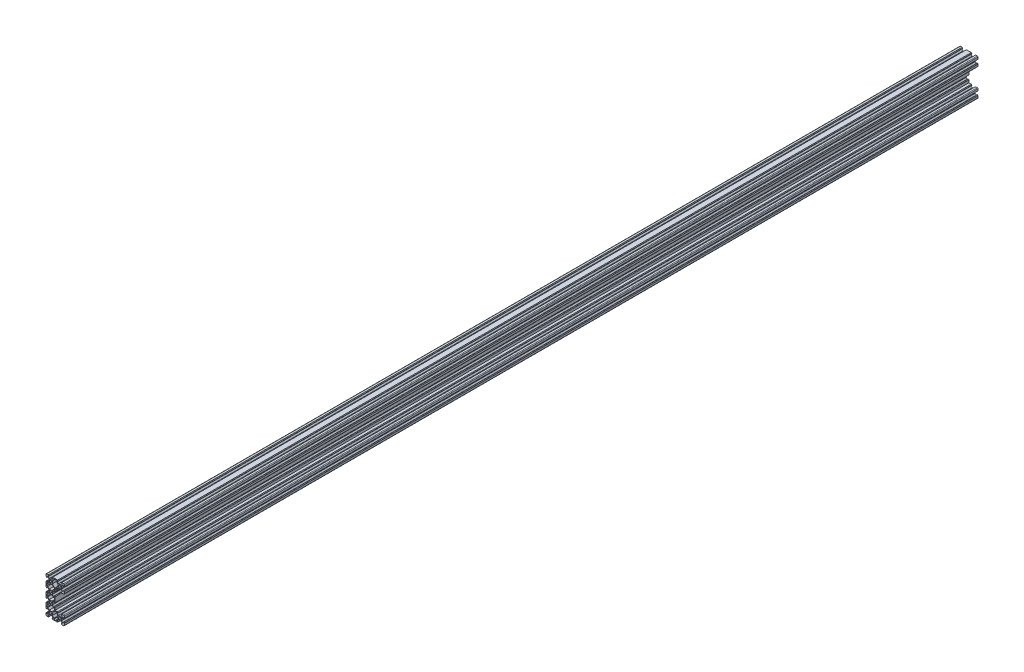
from build123d import *

# Parameters (mm, degrees)
SKETCH1_R           = 2.3
BOSS_EXTRUDE1_DEPTH = 1000


with BuildPart() as part:
    # Sketch1 → Boss-Extrude1 (new, symmetric)
    with BuildSketch(Plane.XY):
        with BuildLine():
            Line((-20, -34.58), (-20, -38.5))
            ThreePointArc((-20, -38.5), (-19.560660172, -39.560660172), (-18.5, -40))
            Line((-18.5, -40), (-14.58, -40))
            Line((-14.58, -40), (-13.395, -38.815))
            Line((-13.395, -38.815), (-13.395, -38.2))
            Line((-13.395, -38.2), (-15.5, -38.2))
            Line((-15.5, -38.2), (-15.5, -36.560660172))
            Line((-15.5, -36.560660172), (-12.839339828, -33.9))
            Line((-12.839339828, -33.9), (-10.21, -33.9))
            Line((-10.21, -33.9), (-10, -33.69))
            Line((-10, -33.69), (-9.79, -33.9))
            Line((-9.79, -33.9), (-7.160660172, -33.9))
            Line((-7.160660172, -33.9), (-4.5, -36.560660172))
            Line((-4.5, -36.560660172), (-4.5, -38.2))
            Line((-4.5, -38.2), (-6.605, -38.2))
            Line((-6.605, -38.2), (-6.605, -38.815))
            Line((-6.605, -38.815), (-5.42, -40))
            Line((-5.42, -40), (5.42, -40))
            Line((5.42, -40), (6.605, -38.815))
            Line((6.605, -38.815), (6.605, -38.2))
            Line((6.605, -38.2), (4.5, -38.2))
            Line((4.5, -38.2), (4.5, -36.560660172))
            Line((4.5, -36.560660172), (7.160660172, -33.9))
            Line((7.160660172, -33.9), (9.79, -33.9))
            Line((9.79, -33.9), (10, -33.69))
            Line((10, -33.69), (10.21, -33.9))
            Line((10.21, -33.9), (12.839339828, -33.9))
            Line((12.839339828, -33.9), (15.5, -36.560660172))
            Line((15.5, -36.560660172), (15.5, -38.2))
            Line((15.5, -38.2), (13.395, -38.2))
            Line((13.395, -38.2), (13.395, -38.815))
            Line((13.395, -38.815), (14.58, -40))
            Line((14.58, -40), (18.5, -40))
            ThreePointArc((18.5, -40), (19.560660172, -39.560660172), (20, -38.5))
            Line((20, -38.5), (20, -34.58))
            Line((20, -34.58), (18.815, -33.395))
            Line((18.815, -33.395), (18.2, -33.395))
            Line((18.2, -33.395), (18.2, -35.5))
            Line((18.2, -35.5), (16.560660172, -35.5))
            Line((16.560660172, -35.5), (13.9, -32.839339828))
            Line((13.9, -32.839339828), (13.9, -30.21))
            Line((13.9, -30.21), (13.69, -30))
            Line((13.69, -30), (13.9, -29.79))
            Line((13.9, -29.79), (13.9, -27.160660172))
            Line((13.9, -27.160660172), (16.560660172, -24.5))
            Line((16.560660172, -24.5), (18.2, -24.5))
            Line((18.2, -24.5), (18.2, -26.605))
            Line((18.2, -26.605), (18.815, -26.605))
            Line((18.815, -26.605), (20, -25.42))
            Line((20, -25.42), (20, -21.5))
            ThreePointArc((20, -21.5), (19.560660172, -20.439339828), (18.5, -20))
            Line((18.5, -20), (14.58, -20))
            Line((14.58, -20), (13.395, -21.185))
            Line((13.395, -21.185), (13.395, -21.8))
            Line((13.395, -21.8), (15.5, -21.8))
            Line((15.5, -21.8), (15.5, -23.439339828))
            Line((15.5, -23.439339828), (12.839339828, -26.1))
            Line((12.839339828, -26.1), (10.21, -26.1))
            Line((10.21, -26.1), (10, -26.31))
            Line((10, -26.31), (9.79, -26.1))
            Line((9.79, -26.1), (7.160660172, -26.1))
            Line((7.160660172, -26.1), (4.5, -23.439339828))
            Line((4.5, -23.439339828), (4.5, -21.8))
            Line((4.5, -21.8), (6.605, -21.8))
            Line((6.605, -21.8), (6.605, -21.185))
            Line((6.605, -21.185), (5.42, -20))
            Line((5.42, -20), (0, -20))
            Line((0, -20), (0, -14.58))
            Line((0, -14.58), (-1.185, -13.395))
            Line((-1.185, -13.395), (-1.8, -13.395))
            Line((-1.8, -13.395), (-1.8, -15.5))
            Line((-1.8, -15.5), (-3.439339828, -15.5))
            Line((-3.439339828, -15.5), (-6.1, -12.839339828))
            Line((-6.1, -12.839339828), (-6.1, -10.21))
            Line((-6.1, -10.21), (-6.31, -10))
            Line((-6.31, -10), (-6.1, -9.79))
            Line((-6.1, -9.79), (-6.1, -7.160660172))
            Line((-6.1, -7.160660172), (-3.439339828, -4.5))
            Line((-3.439339828, -4.5), (-1.8, -4.5))
            Line((-1.8, -4.5), (-1.8, -6.605))
            Line((-1.8, -6.605), (-1.185, -6.605))
            Line((-1.185, -6.605), (0, -5.42))
            Line((0, -5.42), (0, 5.42))
            Line((0, 5.42), (-1.185, 6.605))
            Line((-1.185, 6.605), (-1.8, 6.605))
            Line((-1.8, 6.605), (-1.8, 4.5))
            Line((-1.8, 4.5), (-3.439339828, 4.5))
            Line((-3.439339828, 4.5), (-6.1, 7.160660172))
            Line((-6.1, 7.160660172), (-6.1, 9.79))
            Line((-6.1, 9.79), (-6.31, 10))
            Line((-6.31, 10), (-6.1, 10.21))
            Line((-6.1, 10.21), (-6.1, 12.839339828))
            Line((-6.1, 12.839339828), (-3.439339828, 15.5))
            Line((-3.439339828, 15.5), (-1.8, 15.5))
            Line((-1.8, 15.5), (-1.8, 13.395))
            Line((-1.8, 13.395), (-1.185, 13.395))
            Line((-1.185, 13.395), (0, 14.58))
            Line((0, 14.58), (0, 20))
            Line((0, 20), (5.42, 20))
            Line((5.42, 20), (6.605, 21.185))
            Line((6.605, 21.185), (6.605, 21.8))
            Line((6.605, 21.8), (4.5, 21.8))
            Line((4.5, 21.8), (4.5, 23.439339828))
            Line((4.5, 23.439339828), (7.160660172, 26.1))
            Line((7.160660172, 26.1), (9.79, 26.1))
            Line((9.79, 26.1), (10, 26.31))
            Line((10, 26.31), (10.21, 26.1))
            Line((10.21, 26.1), (12.839339828, 26.1))
            Line((12.839339828, 26.1), (15.5, 23.439339828))
            Line((15.5, 23.439339828), (15.5, 21.8))
            Line((15.5, 21.8), (13.395, 21.8))
            Line((13.395, 21.8), (13.395, 21.185))
            Line((13.395, 21.185), (14.58, 20))
            Line((14.58, 20), (18.5, 20))
            ThreePointArc((18.5, 20), (19.560660172, 20.439339828), (20, 21.5))
            Line((20, 21.5), (20, 25.42))
            Line((20, 25.42), (18.815, 26.605))
            Line((18.815, 26.605), (18.2, 26.605))
            Line((18.2, 26.605), (18.2, 24.5))
            Line((18.2, 24.5), (16.560660172, 24.5))
            Line((16.560660172, 24.5), (13.9, 27.160660172))
            Line((13.9, 27.160660172), (13.9, 29.79))
            Line((13.9, 29.79), (13.69, 30))
            Line((13.69, 30), (13.9, 30.21))
            Line((13.9, 30.21), (13.9, 32.839339828))
            Line((13.9, 32.839339828), (16.560660172, 35.5))
            Line((16.560660172, 35.5), (18.2, 35.5))
            Line((18.2, 35.5), (18.2, 33.395))
            Line((18.2, 33.395), (18.815, 33.395))
            Line((18.815, 33.395), (20, 34.58))
            Line((20, 34.58), (20, 38.5))
            ThreePointArc((20, 38.5), (19.560660172, 39.560660172), (18.5, 40))
            Line((18.5, 40), (14.58, 40))
            Line((14.58, 40), (13.395, 38.815))
            Line((13.395, 38.815), (13.395, 38.2))
            Line((13.395, 38.2), (15.5, 38.2))
            Line((15.5, 38.2), (15.5, 36.560660172))
            Line((15.5, 36.560660172), (12.839339828, 33.9))
            Line((12.839339828, 33.9), (10.21, 33.9))
            Line((10.21, 33.9), (10, 33.69))
            Line((10, 33.69), (9.79, 33.9))
            Line((9.79, 33.9), (7.160660172, 33.9))
            Line((7.160660172, 33.9), (4.5, 36.560660172))
            Line((4.5, 36.560660172), (4.5, 38.2))
            Line((4.5, 38.2), (6.605, 38.2))
            Line((6.605, 38.2), (6.605, 38.815))
            Line((6.605, 38.815), (5.42, 40))
            Line((5.42, 40), (-5.42, 40))
            Line((-5.42, 40), (-6.605, 38.815))
            Line((-6.605, 38.815), (-6.605, 38.2))
            Line((-6.605, 38.2), (-4.5, 38.2))
            Line((-4.5, 38.2), (-4.5, 36.560660172))
            Line((-4.5, 36.560660172), (-7.160660172, 33.9))
            Line((-7.160660172, 33.9), (-9.79, 33.9))
            Line((-9.79, 33.9), (-10, 33.69))
            Line((-10, 33.69), (-10.21, 33.9))
            Line((-10.21, 33.9), (-12.839339828, 33.9))
            Line((-12.839339828, 33.9), (-15.5, 36.560660172))
            Line((-15.5, 36.560660172), (-15.5, 38.2))
            Line((-15.5, 38.2), (-13.395, 38.2))
            Line((-13.395, 38.2), (-13.395, 38.815))
            Line((-13.395, 38.815), (-14.58, 40))
            Line((-14.58, 40), (-18.5, 40))
            ThreePointArc((-18.5, 40), (-19.560660172, 39.560660172), (-20, 38.5))
            Line((-20, 38.5), (-20, 34.58))
            Line((-20, 34.58), (-18.815, 33.395))
            Line((-18.815, 33.395), (-18.2, 33.395))
            Line((-18.2, 33.395), (-18.2, 35.5))
            Line((-18.2, 35.5), (-16.560660172, 35.5))
            Line((-16.560660172, 35.5), (-13.9, 32.839339828))
            Line((-13.9, 32.839339828), (-13.9, 30.21))
            Line((-13.9, 30.21), (-13.69, 30))
            Line((-13.69, 30), (-13.9, 29.79))
            Line((-13.9, 29.79), (-13.9, 27.160660172))
            Line((-13.9, 27.160660172), (-16.560660172, 24.5))
            Line((-16.560660172, 24.5), (-18.2, 24.5))
            Line((-18.2, 24.5), (-18.2, 26.605))
            Line((-18.2, 26.605), (-18.815, 26.605))
            Line((-18.815, 26.605), (-20, 25.42))
            Line((-20, 25.42), (-20, 14.58))
            Line((-20, 14.58), (-18.815, 13.395))
            Line((-18.815, 13.395), (-18.2, 13.395))
            Line((-18.2, 13.395), (-18.2, 15.5))
            Line((-18.2, 15.5), (-16.560660172, 15.5))
            Line((-16.560660172, 15.5), (-13.9, 12.839339828))
            Line((-13.9, 12.839339828), (-13.9, 10.21))
            Line((-13.9, 10.21), (-13.69, 10))
            Line((-13.69, 10), (-13.9, 9.79))
            Line((-13.9, 9.79), (-13.9, 7.160660172))
            Line((-13.9, 7.160660172), (-16.560660172, 4.5))
            Line((-16.560660172, 4.5), (-18.2, 4.5))
            Line((-18.2, 4.5), (-18.2, 6.605))
            Line((-18.2, 6.605), (-18.815, 6.605))
            Line((-18.815, 6.605), (-20, 5.42))
            Line((-20, 5.42), (-20, -5.42))
            Line((-20, -5.42), (-18.815, -6.605))
            Line((-18.815, -6.605), (-18.2, -6.605))
            Line((-18.2, -6.605), (-18.2, -4.5))
            Line((-18.2, -4.5), (-16.560660172, -4.5))
            Line((-16.560660172, -4.5), (-13.9, -7.160660172))
            Line((-13.9, -7.160660172), (-13.9, -9.79))
            Line((-13.9, -9.79), (-13.69, -10))
            Line((-13.69, -10), (-13.9, -10.21))
            Line((-13.9, -10.21), (-13.9, -12.839339828))
            Line((-13.9, -12.839339828), (-16.560660172, -15.5))
            Line((-16.560660172, -15.5), (-18.2, -15.5))
            Line((-18.2, -15.5), (-18.2, -13.395))
            Line((-18.2, -13.395), (-18.815, -13.395))
            Line((-18.815, -13.395), (-20, -14.58))
            Line((-20, -14.58), (-20, -25.42))
            Line((-20, -25.42), (-18.815, -26.605))
            Line((-18.815, -26.605), (-18.2, -26.605))
            Line((-18.2, -26.605), (-18.2, -24.5))
            Line((-18.2, -24.5), (-16.560660172, -24.5))
            Line((-16.560660172, -24.5), (-13.9, -27.160660172))
            Line((-13.9, -27.160660172), (-13.9, -29.79))
            Line((-13.9, -29.79), (-13.69, -30))
            Line((-13.69, -30), (-13.9, -30.21))
            Line((-13.9, -30.21), (-13.9, -32.839339828))
            Line((-13.9, -32.839339828), (-16.560660172, -35.5))
            Line((-16.560660172, -35.5), (-18.2, -35.5))
            Line((-18.2, -35.5), (-18.2, -33.395))
            Line((-18.2, -33.395), (-18.815, -33.395))
            Line((-18.815, -33.395), (-20, -34.58))
        make_face()
        with Locations((-10, -30)):
            Circle(SKETCH1_R, mode=Mode.SUBTRACT)
        Polygon((-16.239339828, -22.7), (-18.2, -22.7), (-18.2, -17.3), (-16.239339828, -17.3), (-12.839339828, -13.9), (-7.160660172, -13.9), (-3.760660172, -17.3), (-1.8, -17.3), (-1.8, -20.739339828), (-7.160660172, -26.1), (-12.839339828, -26.1), align=None, mode=Mode.SUBTRACT)
        with Locations((-10, -10)):
            Circle(SKETCH1_R, mode=Mode.SUBTRACT)
        Polygon((2.7, -36.239339828), (2.7, -38.2), (-2.7, -38.2), (-2.7, -36.239339828), (-6.1, -32.839339828), (-6.1, -27.160660172), (-0.739339828, -21.8), (2.7, -21.8), (2.7, -23.760660172), (6.1, -27.160660172), (6.1, -32.839339828), align=None, mode=Mode.SUBTRACT)
        with Locations((10, -30)):
            Circle(SKETCH1_R, mode=Mode.SUBTRACT)
        Polygon((-16.239339828, -2.7), (-18.2, -2.7), (-18.2, 2.7), (-16.239339828, 2.7), (-12.839339828, 6.1), (-7.160660172, 6.1), (-3.760660172, 2.7), (-1.8, 2.7), (-1.8, -2.7), (-3.760660172, -2.7), (-7.160660172, -6.1), (-12.839339828, -6.1), align=None, mode=Mode.SUBTRACT)
        with Locations((-10, 10)):
            Circle(SKETCH1_R, mode=Mode.SUBTRACT)
        Polygon((-16.239339828, 17.3), (-18.2, 17.3), (-18.2, 22.7), (-16.239339828, 22.7), (-12.839339828, 26.1), (-7.160660172, 26.1), (-1.8, 20.739339828), (-1.8, 17.3), (-3.760660172, 17.3), (-7.160660172, 13.9), (-12.839339828, 13.9), align=None, mode=Mode.SUBTRACT)
        with Locations((-10, 30)):
            Circle(SKETCH1_R, mode=Mode.SUBTRACT)
        Polygon((-2.7, 36.239339828), (-2.7, 38.2), (2.7, 38.2), (2.7, 36.239339828), (6.1, 32.839339828), (6.1, 27.160660172), (2.7, 23.760660172), (2.7, 21.8), (-0.739339828, 21.8), (-6.1, 27.160660172), (-6.1, 32.839339828), align=None, mode=Mode.SUBTRACT)
        with Locations((10, 30)):
            Circle(SKETCH1_R, mode=Mode.SUBTRACT)
    extrude(amount=BOSS_EXTRUDE1_DEPTH, both=True)


solid = part.part
